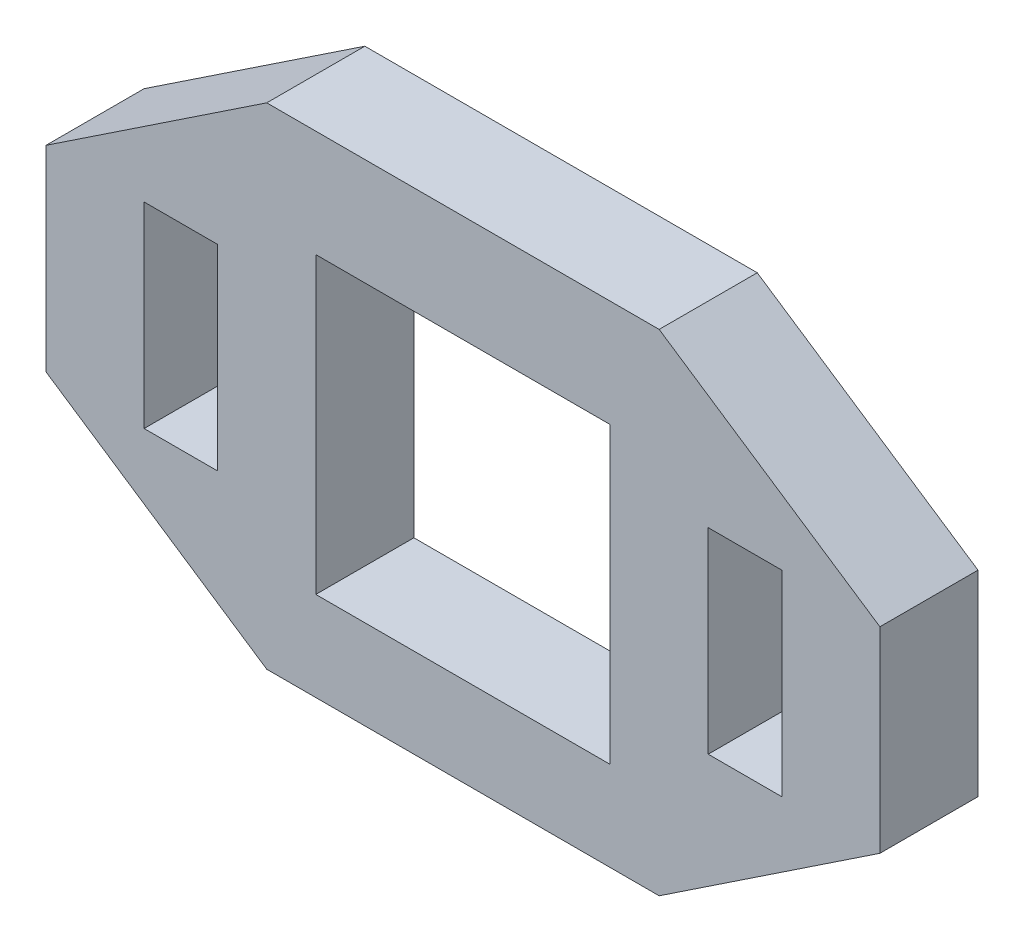
from build123d import *

# Parameters (mm, degrees)
SKETCH1_W           = 19.05
SKETCH1_H           = 50.8
SKETCH1_W_2         = 76.2
SKETCH1_H_2         = 76.2
BOSS_EXTRUDE1_DEPTH = 25.4


with BuildPart() as part:
    # Sketch1 → Boss-Extrude1 (new body)
    with BuildSketch(Plane.XY):
        Polygon((0, 0), (0, 50.8), (57.15, 88.9), (158.75, 88.9), (215.9, 50.8), (215.9, 0), (158.75, -38.1), (57.15, -38.1), align=None)
        with Locations((34.925, 25.4)):
            Rectangle(SKETCH1_W, SKETCH1_H, mode=Mode.SUBTRACT)
        with Locations((107.95, 23.124358826)):
            Rectangle(SKETCH1_W_2, SKETCH1_H_2, mode=Mode.SUBTRACT)
        with Locations((180.975, 25.4)):
            Rectangle(SKETCH1_W, SKETCH1_H, mode=Mode.SUBTRACT)
    extrude(amount=BOSS_EXTRUDE1_DEPTH)


solid = part.part
